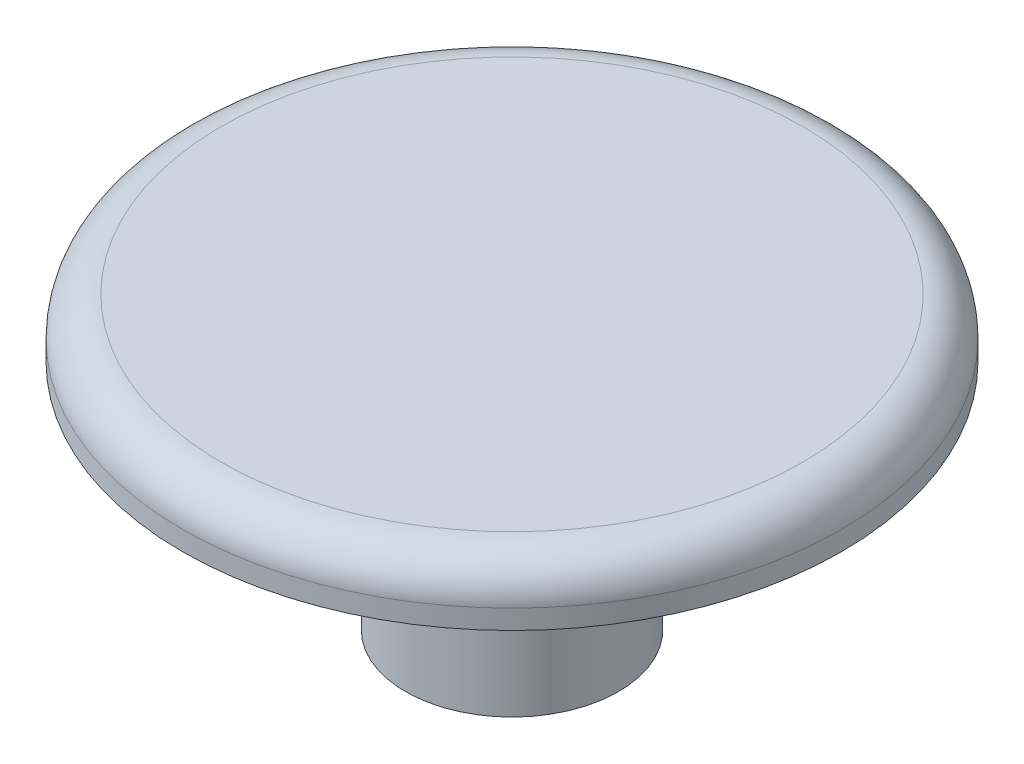
from build123d import *


with BuildPart() as part:
    # Sketch1 → Revolve1 (revolve)
    with BuildSketch(Plane.XY, mode=Mode.PRIVATE) as revolve1_sk:
        with BuildLine():
            Line((0, 0), (5.5, 0))
            Line((5.5, 0), (5.5, 12))
            Line((5.5, 12), (17, 12))
            Line((17, 12), (17, 13))
            ThreePointArc((17, 13), (16.414213562, 14.414213562), (15, 15))
            Line((15, 15), (0, 15))
            Line((0, 15), (0, 0))
        make_face()
    revolve(revolve1_sk.sketch.rotate(Axis((0, 0, 0), (0, 1, 0)), 90), axis=Axis((0, 0, 0), (0, 1, 0)))


solid = part.part
